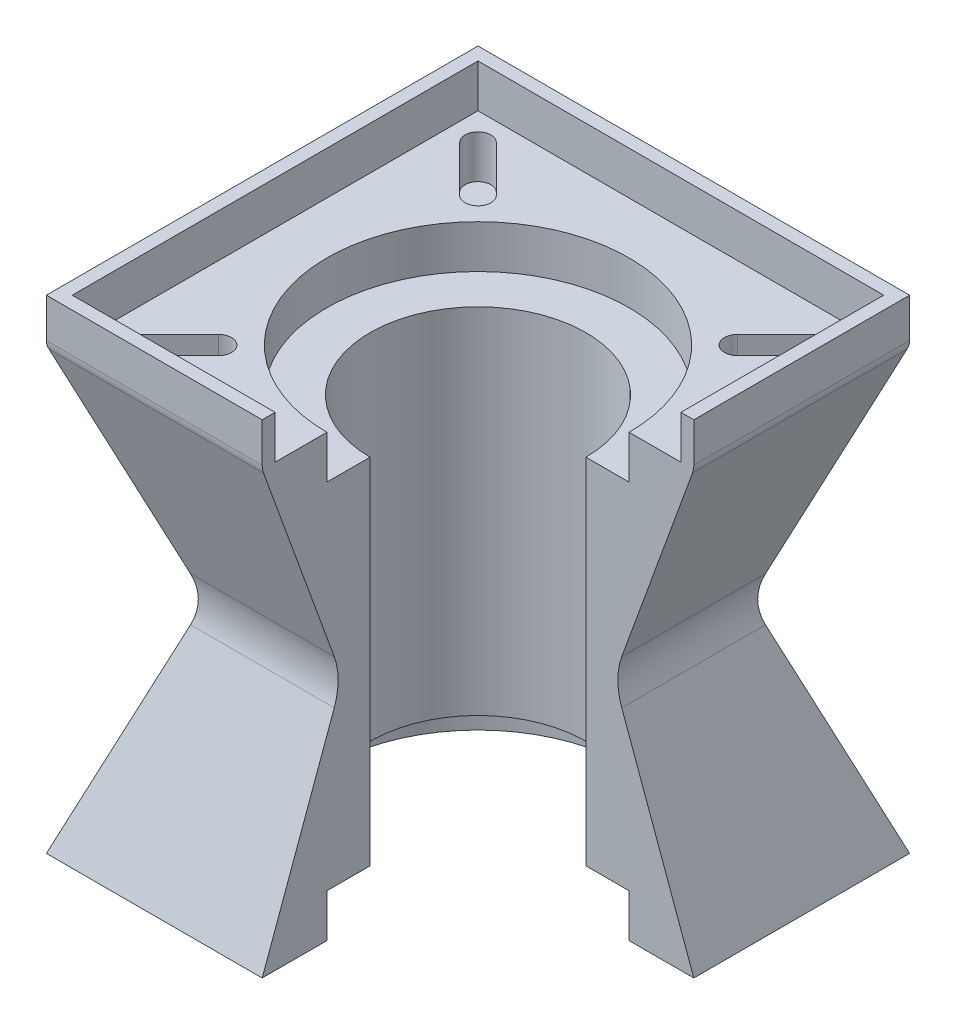
from build123d import *

# Parameters (mm, degrees)
BOSS_EXTRU_1_DEPTH           = 100
ENL_V_MAT_EXTRU_1_DEPTH      = 139.683341994
ENL_V_MAT_EXTRU_1_DEPTH_BACK = 139.683341994
ESQUISSE4_R                  = 25
ENL_V_MAT_EXTRU_2_DEPTH      = 165.426486147
ESQUISSE5_R                  = 35
ENL_V_MAT_EXTRU_3_DEPTH      = 10
ESQUISSE6_W                  = 54.725773432
ESQUISSE6_H                  = 55.483939058
ENL_V_MAT_EXTRU_4_DEPTH      = 165.426486147
CONG_2_R                     = 15
CONG_3_R                     = 15
ENL_V_START                  = -10
ESQUISSE8_R                  = 35
ENL_V_MAT_EXTRU_5_DEPTH      = 10
BOSS_EXTRU_2_DEPTH           = 10
ENL_V_MAT_EXTRU_7_DEPTH      = 10
CONG_5_R                     = 5


with BuildPart() as part:
    # Esquisse1 → Boss.-Extru.1 (new body)
    with BuildSketch(Plane.XY):
        Polygon((81.437518052, 51), (-18.562481948, 51), (0, 0), (62.875036105, 0), align=None)
        Polygon((-18.562481948, -51), (0, 0), (62.875036105, 0), (81.437518052, -51), align=None)
    extrude(amount=BOSS_EXTRU_1_DEPTH)

    # Esquisse3 → Enlèv. mat.-Extru.1 (cut, two sides: drawn at the far end of the back side and taken through both)
    with BuildSketch(Plane(origin=(0, 0, 0), x_dir=(0, 0, -1), z_dir=(1, 0, 0)).offset(-ENL_V_MAT_EXTRU_1_DEPTH_BACK)):
        Polygon((-18.562481948, 0), (0, 0), (0, 51), align=None)
        Polygon((0, 0), (0, -51), (-18.562481948, 0), align=None)
        Polygon((-100, 0), (-100, 51), (-81.437518052, 0), align=None)
        Polygon((-81.437518052, 0), (-100, 0), (-100, -51), align=None)
    extrude(amount=ENL_V_MAT_EXTRU_1_DEPTH + ENL_V_MAT_EXTRU_1_DEPTH_BACK, mode=Mode.SUBTRACT)

    # Esquisse4 → Enlèv. mat.-Extru.2 (cut, through all)
    with BuildSketch(Plane(origin=(0, 51, 0), x_dir=(1, 0, 0), z_dir=(0, 1, 0))):
        with Locations(Location((31.437518052, -50, 0), (0, 0, 180))):
            Circle(ESQUISSE4_R)
    extrude(amount=-ENL_V_MAT_EXTRU_2_DEPTH, mode=Mode.SUBTRACT)

    # Esquisse5 → Enlèv. mat.-Extru.3 (cut)
    with BuildSketch(Plane(origin=(0, 51, 0), x_dir=(1, 0, 0), z_dir=(0, 1, 0))):
        with Locations(Location((31.437518052, -50, 0), (0, 0, 180))):
            Circle(ESQUISSE5_R)
    extrude(amount=-ENL_V_MAT_EXTRU_3_DEPTH, mode=Mode.SUBTRACT)

    # Esquisse6 → Enlèv. mat.-Extru.4 (cut, through all)
    with BuildSketch(Plane(origin=(0, 51, 0), x_dir=(1, 0, 0), z_dir=(0, 1, 0))):
        with Locations((58.800404768, -77.741969529)):
            Rectangle(ESQUISSE6_W, ESQUISSE6_H)
    extrude(amount=-ENL_V_MAT_EXTRU_4_DEPTH, mode=Mode.SUBTRACT)

    # Congé2
    cong_2_edges = [part.edges().sort_by_distance(p)[0] for p in [
        (62.875036105, 0, 34.281240974),
    ]]
    fillet(cong_2_edges, radius=CONG_2_R)

    # Congé3
    cong_3_edges = [part.edges().sort_by_distance(p)[0] for p in [
        (31.918851346, 0, 18.562481948),
        (0, 0, 50),
        (15.718759026, 0, 81.437518052),
    ]]
    fillet(cong_3_edges, radius=CONG_3_R)

    # Esquisse8 → Enlèv. mat.-Extru.5 (cut)
    with BuildSketch(Plane.XZ.offset(51).offset(ENL_V_START)):
        with Locations((31.437518052, 50)):
            Circle(ESQUISSE8_R)
    extrude(amount=ENL_V_MAT_EXTRU_5_DEPTH, mode=Mode.SUBTRACT)

    # Esquisse9 → Boss.-Extru.2 (add)
    with BuildSketch(Plane(origin=(0, 51, 0), x_dir=(1, 0, 0), z_dir=(0, 1, 0))):
        Polygon((-18.562481948, -100), (31.437518052, -100), (31.437518052, -97), (28.437518052, -97), (-15.562481948, -97), (-15.562481948, -3), (78.437518052, -3), (78.437518052, -47), (78.437518052, -50), (81.437518052, -50), (81.437518052, 0), (-18.562481948, 0), align=None)
    extrude(amount=BOSS_EXTRU_2_DEPTH)

    # Esquisse11 → Enlèv. mat.-Extru.7 (cut)
    with BuildSketch(Plane(origin=(0, 51, 0), x_dir=(1, 0, 0), z_dir=(0, 1, 0))):
        with BuildLine():
            Line((-0.735840492, -77.930717857), (-11.342442209, -88.537319575))
            ThreePointArc((-11.342442209, -88.537319575), (-11.342442209, -92.779960262), (-7.099801522, -92.779960262))
            Line((-7.099801522, -92.779960262), (3.506800196, -82.173358544))
            ThreePointArc((3.506800196, -82.173358544), (3.506800196, -77.930717857), (-0.735840492, -77.930717857))
        make_face()
        with BuildLine():
            Line((-0.735840492, -22.069282143), (-11.342442209, -11.462680425))
            ThreePointArc((-11.342442209, -11.462680425), (-11.342442209, -7.220039738), (-7.099801522, -7.220039738))
            Line((-7.099801522, -7.220039738), (3.506800196, -17.826641456))
            ThreePointArc((3.506800196, -17.826641456), (3.506800196, -22.069282143), (-0.735840492, -22.069282143))
        make_face()
        with BuildLine():
            Line((63.610876596, -22.069282143), (74.217478314, -11.462680425))
            ThreePointArc((74.217478314, -11.462680425), (74.217478314, -7.220039738), (69.974837627, -7.220039738))
            Line((69.974837627, -7.220039738), (59.368235909, -17.826641456))
            ThreePointArc((59.368235909, -17.826641456), (59.368235909, -22.069282143), (63.610876596, -22.069282143))
        make_face()
    extrude(amount=-ENL_V_MAT_EXTRU_7_DEPTH, mode=Mode.SUBTRACT)

    # Congé5
    cong_5_edges = [part.edges().sort_by_distance(p)[0] for p in [
        (31.437518052, 51, 0),
        (-18.562481948, 51, 50),
        (6.437518052, 51, 100),
        (81.437518052, 51, 25),
    ]]
    fillet(cong_5_edges, radius=CONG_5_R)


solid = part.part
